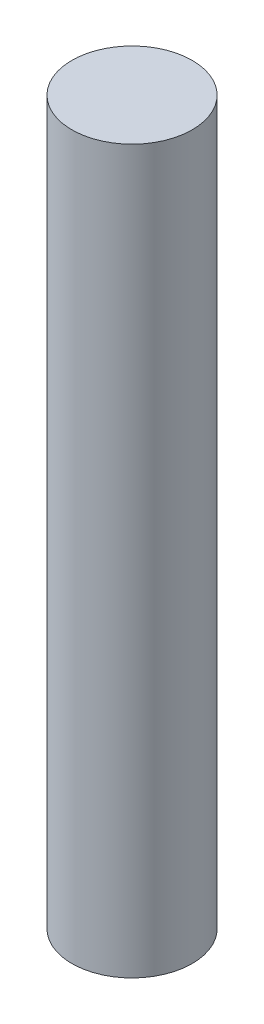
from build123d import *

# Parameters (mm, degrees)
SKETCH1_R           = 6.35
BOSS_EXTRUDE1_DEPTH = 76.2


with BuildPart() as part:
    # Sketch1 → Boss-Extrude1 (new body)
    with BuildSketch(Plane(origin=(0, 0, 0), x_dir=(1, 0, 0), z_dir=(0, 1, 0))):
        with Locations(Location((0, 0, 0), (0, 0, 90))):
            Circle(SKETCH1_R)
    extrude(amount=BOSS_EXTRUDE1_DEPTH)


solid = part.part
